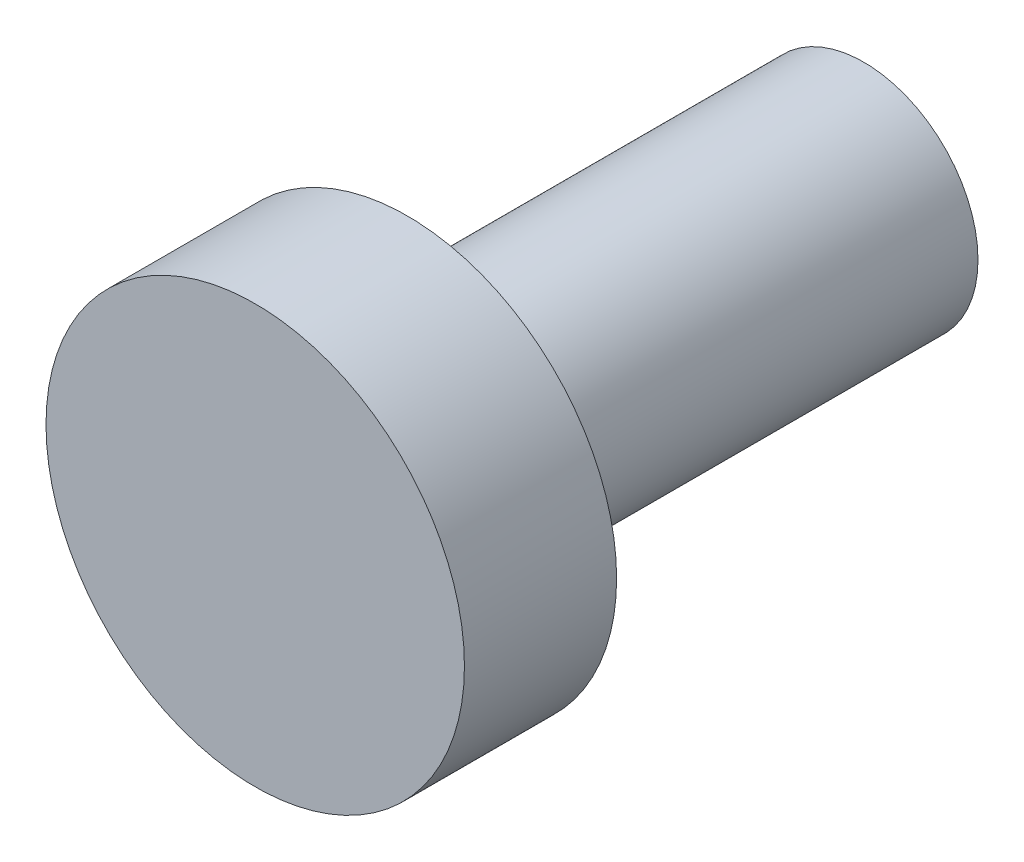
from build123d import *

# Parameters (mm, degrees)
EXTRUDE_START     = -6
SKETCH_1_R        = 1.5
EXTRUDE_M3_DEPTH  = 6
SKETCH_2_R        = 2.75
EXTRUDE_5_5_DEPTH = 2


with BuildPart() as part:
    # 草图1 → M3螺杆_牙型简化 (new body)
    with BuildSketch(Plane.XY.offset(EXTRUDE_START)):
        Circle(SKETCH_1_R)
    extrude(amount=EXTRUDE_M3_DEPTH)

    # 草图2 → 圆柱头_直径5.5 (add)
    with BuildSketch(Plane.XY):
        Circle(SKETCH_2_R)
    extrude(amount=EXTRUDE_5_5_DEPTH)


solid = part.part
